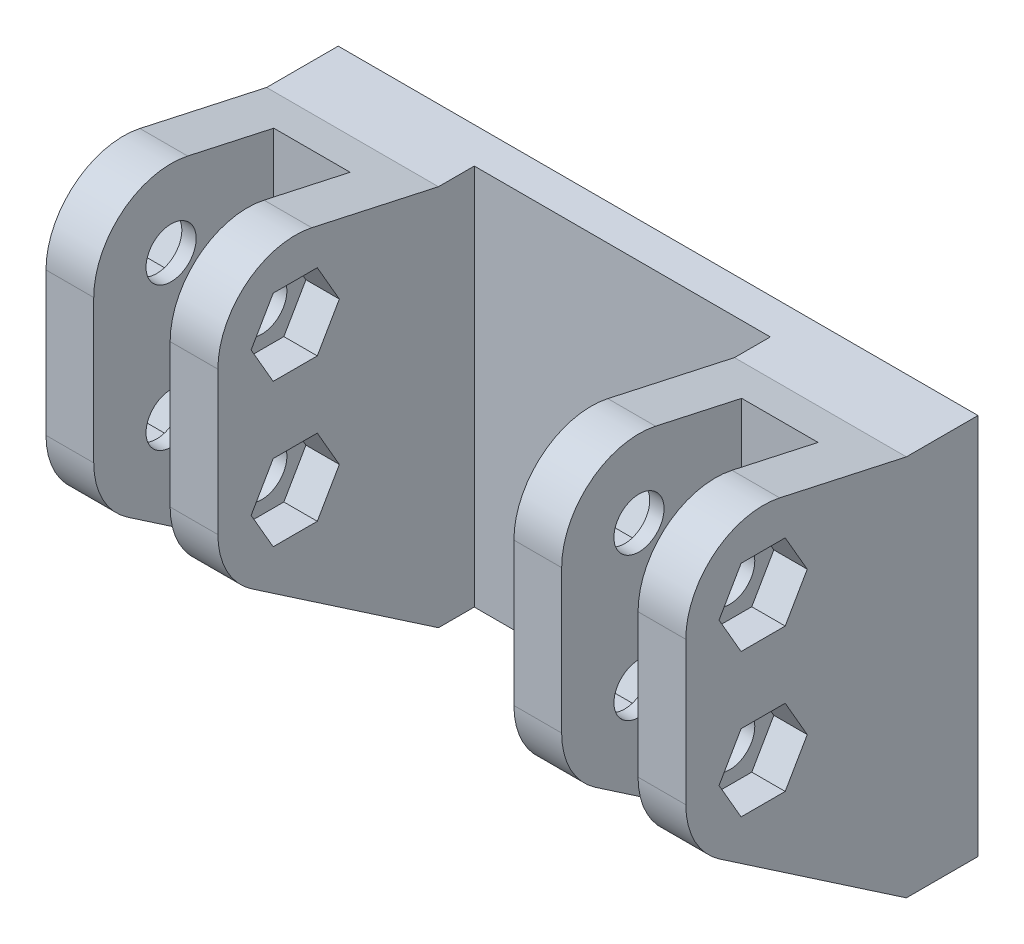
from build123d import *
from build123d.topology import SkipClean

# Parameters (mm, degrees)
SKETCH1_R               = 2.625
BOSS_EXTRUDE1_DEPTH     = 18
SKETCH2_W               = 3.75
SKETCH2_H               = 40
BOSS_EXTRUDE2_DEPTH     = 15.5
CUT_EXTRUDE1_DEPTH      = 3.5
CUT_EXTRUDE2_DEPTH      = 4
CUT_EXTRUDE2_DEPTH_BACK = 4
SKETCH4_W               = 26.185074211
SKETCH4_H               = 43.492971865
CUT_EXTRUDE3_DEPTH      = 3.75


with BuildPart() as part:
    # Sketch1 → Boss-Extrude1 (new body)
    with BuildSketch(Plane(origin=(0, 0, 0), x_dir=(0, 0, -1), z_dir=(1, 0, 0))):
        with BuildLine():
            Line((0, 0), (5, 0))
            Line((5, 0), (5, 40))
            Line((5, 40), (0, 40))
            Line((0, 40), (-2.5, 40))
            Line((-2.5, 40), (-15.763202528, 42.911607583))
            ThreePointArc((-15.763202528, 42.911607583), (-22.576511621, 41.311816677), (-25.6, 35))
            Line((-25.6, 35), (-25.6, 20))
            ThreePointArc((-25.6, 20), (-24.659331675, 16.211336651), (-22.055809883, 13.302642588))
            Line((-22.055809883, 13.302642588), (-2.5, 0))
            Line((-2.5, 0), (0, 0))
        make_face()
        with Locations((-17.5, 35)):
            Circle(SKETCH1_R, mode=Mode.SUBTRACT)
        with Locations((-17.5, 20)):
            Circle(SKETCH1_R, mode=Mode.SUBTRACT)
    extrude(amount=BOSS_EXTRUDE1_DEPTH)

    # Sketch2 → Boss-Extrude2 (add)
    with BuildSketch(Plane.ZY):
        with Locations((-3.125, 20)):
            Rectangle(SKETCH2_W, SKETCH2_H)
    extrude(amount=BOSS_EXTRUDE2_DEPTH)

    # Sketch3 → Cut-Extrude1 (cut)
    with BuildSketch(Plane(origin=(18, 0, 0), x_dir=(0, 0, -1), z_dir=(1, 0, 0))):
        Polygon((-12.881197846, 35), (-15.190598923, 39), (-19.809401077, 39), (-22.118802154, 35), (-19.809401077, 31), (-15.190598923, 31), align=None)
        Polygon((-12.881197846, 20), (-15.190598923, 24), (-19.809401077, 24), (-22.118802154, 20), (-19.809401077, 16), (-15.190598923, 16), align=None)
    cut_extrude1 = extrude(amount=-CUT_EXTRUDE1_DEPTH, mode=Mode.SUBTRACT)

    # Mirror1: Cut-Extrude1 across plane
    add(cut_extrude1.mirror(Plane(origin=(9, 0, 0), x_dir=(0, 0, 1), z_dir=(1, 0, 0))), mode=Mode.SUBTRACT)

    # Sketch4 → Cut-Extrude2 (cut, two sides: drawn at the far end of the back side and taken through both)
    with BuildSketch(Plane(origin=(9, 0, 0), x_dir=(0, 0, -1), z_dir=(1, 0, 0)).offset(-CUT_EXTRUDE2_DEPTH_BACK)):
        with Locations((-19.842537105, 21.746485933)):
            Rectangle(SKETCH4_W, SKETCH4_H)
    extrude(amount=CUT_EXTRUDE2_DEPTH + CUT_EXTRUDE2_DEPTH_BACK, mode=Mode.SUBTRACT)

    # Sketch5 → Cut-Extrude3 (cut)
    with BuildSketch(Plane.XY.offset(-1.25)):
        with BuildLine():
            Line((-15.5, 23.302), (-15.5, 16.698))
            ThreePointArc((-15.5, 16.698), (-12.198, 20), (-15.5, 23.302))
        make_face()
    extrude(amount=-CUT_EXTRUDE3_DEPTH, mode=Mode.SUBTRACT)

    # Mirror2: part across plane


with BuildPart() as part_1:
    with SkipClean():  # the faces are left unmerged after this step: merging them gives an invalid solid
        add(part.part)
        add(part.part.mirror(Plane(origin=(-15.5, 0, 0), x_dir=(0, 0, 1), z_dir=(1, 0, 0))))


solid = part_1.part
